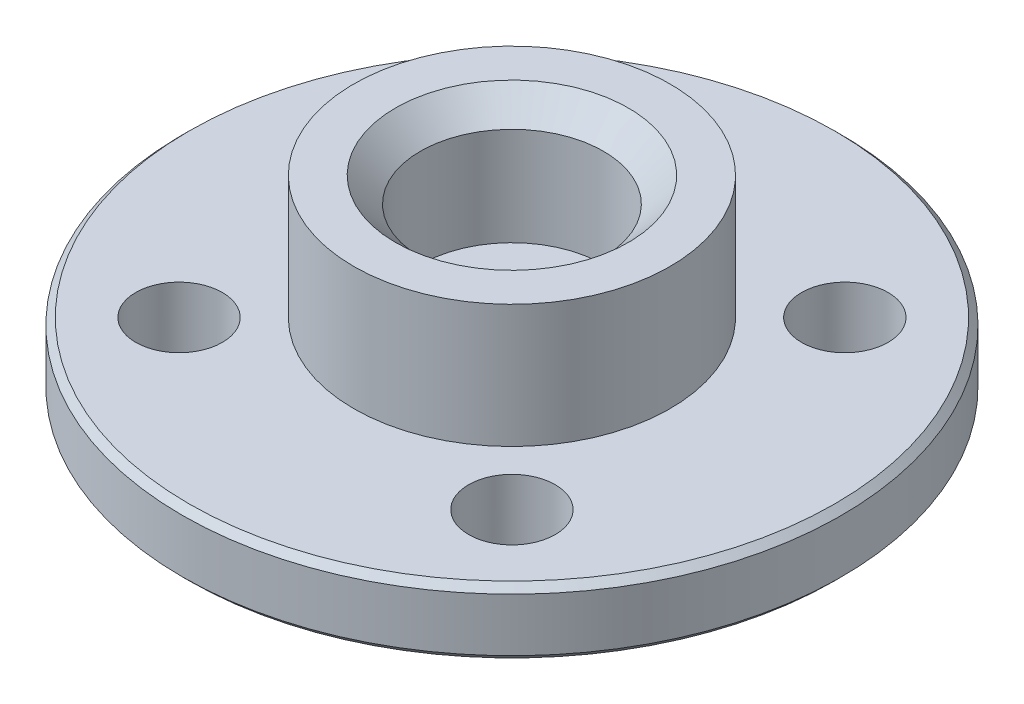
from build123d import *

# Parameters (mm, degrees)
SKETCH1_R           = 9.9
BOSS_EXTRUDE1_DEPTH = 2
SKETCH2_R           = 4.75
SKETCH2_R_2         = 2.75
BOSS_EXTRUDE2_DEPTH = 3.7
CUT_EXTRUDE1_REACH  = 17.117
SKETCH3_R           = 1.3
SKETCH3_R_2         = 1.45
CHAMFER1_SIZE       = 0.75
CHAMFER2_SIZE       = 0.2


with BuildPart() as part:
    # Sketch1 → Boss-Extrude1 (new body)
    with BuildSketch(Plane(origin=(0, 0, 0), x_dir=(1, 0, 0), z_dir=(0, 1, 0))):
        with Locations(Location((0, 0, 0), (0, 0, 270))):
            Circle(SKETCH1_R)
    extrude(amount=BOSS_EXTRUDE1_DEPTH)

    # Sketch2 → Boss-Extrude2 (add)
    with BuildSketch(Plane(origin=(0, 2, 0), x_dir=(1, 0, 0), z_dir=(0, 1, 0))):
        with Locations(Location((0, 0, 0), (0, 0, 270))):
            Circle(SKETCH2_R)
        with Locations(Location((0, 0, 0), (0, 0, 270))):
            Circle(SKETCH2_R_2, mode=Mode.SUBTRACT)
    extrude(amount=BOSS_EXTRUDE2_DEPTH)

    # Sketch3 → Cut-Extrude1 (cut, up to next)
    with BuildSketch(Plane.XZ, mode=Mode.PRIVATE) as cut_extrude1_sk1:
        with Locations(Location((-5, 5, 0), (0, 0, 270))):
            Circle(SKETCH3_R)
    cut_extrude1_tool1 = extrude(cut_extrude1_sk1.sketch, amount=-CUT_EXTRUDE1_REACH, mode=Mode.PRIVATE) & part.part
    # Sketch3 → Cut-Extrude1 (cut, up to next)
    with BuildSketch(Plane.XZ, mode=Mode.PRIVATE) as cut_extrude1_sk2:
        with Locations(Location((5, 5, 0), (0, 0, 270))):
            Circle(SKETCH3_R)
    cut_extrude1_tool2 = extrude(cut_extrude1_sk2.sketch, amount=-CUT_EXTRUDE1_REACH, mode=Mode.PRIVATE) & part.part
    # Sketch3 → Cut-Extrude1 (cut, up to next)
    with BuildSketch(Plane.XZ, mode=Mode.PRIVATE) as cut_extrude1_sk3:
        with Locations(Location((-5, -5, 0), (0, 0, 270))):
            Circle(SKETCH3_R)
    cut_extrude1_tool3 = extrude(cut_extrude1_sk3.sketch, amount=-CUT_EXTRUDE1_REACH, mode=Mode.PRIVATE) & part.part
    # Sketch3 → Cut-Extrude1 (cut, up to next)
    with BuildSketch(Plane.XZ, mode=Mode.PRIVATE) as cut_extrude1_sk4:
        with Locations(Location((5, -5, 0), (0, 0, 270))):
            Circle(SKETCH3_R)
    cut_extrude1_tool4 = extrude(cut_extrude1_sk4.sketch, amount=-CUT_EXTRUDE1_REACH, mode=Mode.PRIVATE) & part.part
    # Sketch3 → Cut-Extrude1 (cut, up to next)
    with BuildSketch(Plane.XZ, mode=Mode.PRIVATE) as cut_extrude1_sk5:
        with Locations(Location((0, 0, 0), (0, 0, 270))):
            Circle(SKETCH3_R_2)
    cut_extrude1_tool5 = extrude(cut_extrude1_sk5.sketch, amount=-CUT_EXTRUDE1_REACH, mode=Mode.PRIVATE) & part.part
    add(cut_extrude1_tool1.solids().sort_by_distance((-5, 0, 5))[0], mode=Mode.SUBTRACT)
    add(cut_extrude1_tool2.solids().sort_by_distance((5, 0, 5))[0], mode=Mode.SUBTRACT)
    add(cut_extrude1_tool3.solids().sort_by_distance((-5, 0, -5))[0], mode=Mode.SUBTRACT)
    add(cut_extrude1_tool4.solids().sort_by_distance((5, 0, -5))[0], mode=Mode.SUBTRACT)
    add(cut_extrude1_tool5.solids().sort_by_distance((0, 0, 0))[0], mode=Mode.SUBTRACT)

    # Chamfer1
    chamfer1_edges = [part.edges().sort_by_distance(p)[0] for p in [
        (0, 5.7, -2.75),
    ]]
    chamfer(chamfer1_edges, length=CHAMFER1_SIZE)

    # Chamfer2
    chamfer2_edges = [part.edges().sort_by_distance(p)[0] for p in [
        (0, 0, -9.9),
        (0, 2, -9.9),
    ]]
    chamfer(chamfer2_edges, length=CHAMFER2_SIZE)


solid = part.part
